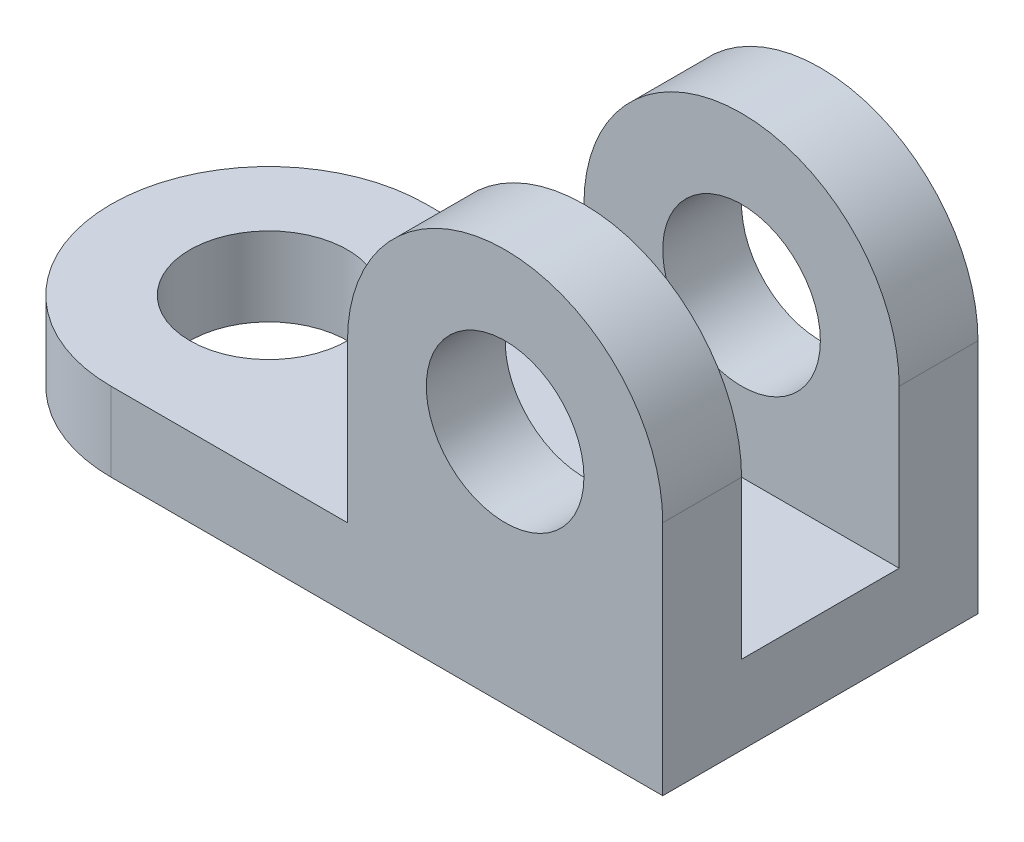
from build123d import *

# Parameters (mm, degrees)
CROQUIS2_R              = 12.7
SALIENTE_EXTRUIR1_DEPTH = 12.7
CROQUIS4_R              = 12.7
SALIENTE_EXTRUIR4_DEPTH = 50.8
CORTAR_EXTRUIR1_START   = -12.7
CROQUIS4_5_R            = 12.7
CORTAR_EXTRUIR1_DEPTH   = 25.4


with BuildPart() as part:
    # Croquis2 → Saliente-Extruir1 (new body)
    with BuildSketch(Plane(origin=(0, 0, 0), x_dir=(1, 0, 0), z_dir=(0, 1, 0))):
        with BuildLine():
            Line((0, 0), (0, 50.8))
            Line((0, 50.8), (-88.9, 50.8))
            ThreePointArc((-88.9, 50.8), (-114.3, 25.4), (-88.9, 0))
            Line((-88.9, 0), (0, 0))
        make_face()
        with Locations(Location((-88.9, 25.4, 0), (0, 0, 270))):
            Circle(CROQUIS2_R, mode=Mode.SUBTRACT)
    extrude(amount=SALIENTE_EXTRUIR1_DEPTH)

    # Croquis4 → Saliente-Extruir4 (add, through all)
    with BuildSketch(Plane.XY):
        with BuildLine():
            Line((0, 12.7), (0, 38.1))
            ThreePointArc((0, 38.1), (-25.4, 63.5), (-50.8, 38.1))
            Line((-50.8, 38.1), (-50.8, 12.7))
            Line((-50.8, 12.7), (0, 12.7))
        make_face()
        with Locations((-25.4, 38.1)):
            Circle(CROQUIS4_R, mode=Mode.SUBTRACT)
    extrude(amount=-SALIENTE_EXTRUIR4_DEPTH)

    # Croquis4<5> → Cortar-Extruir1 (cut)
    with BuildSketch(Plane.XY.offset(CORTAR_EXTRUIR1_START)):
        with BuildLine():
            Line((0, 12.7), (0, 38.1))
            ThreePointArc((0, 38.1), (-25.4, 63.5), (-50.8, 38.1))
            Line((-50.8, 38.1), (-50.8, 12.7))
            Line((-50.8, 12.7), (0, 12.7))
        make_face()
        with Locations((-25.4, 38.1)):
            Circle(CROQUIS4_5_R, mode=Mode.SUBTRACT)
    extrude(amount=-CORTAR_EXTRUIR1_DEPTH, mode=Mode.SUBTRACT)


solid = part.part
